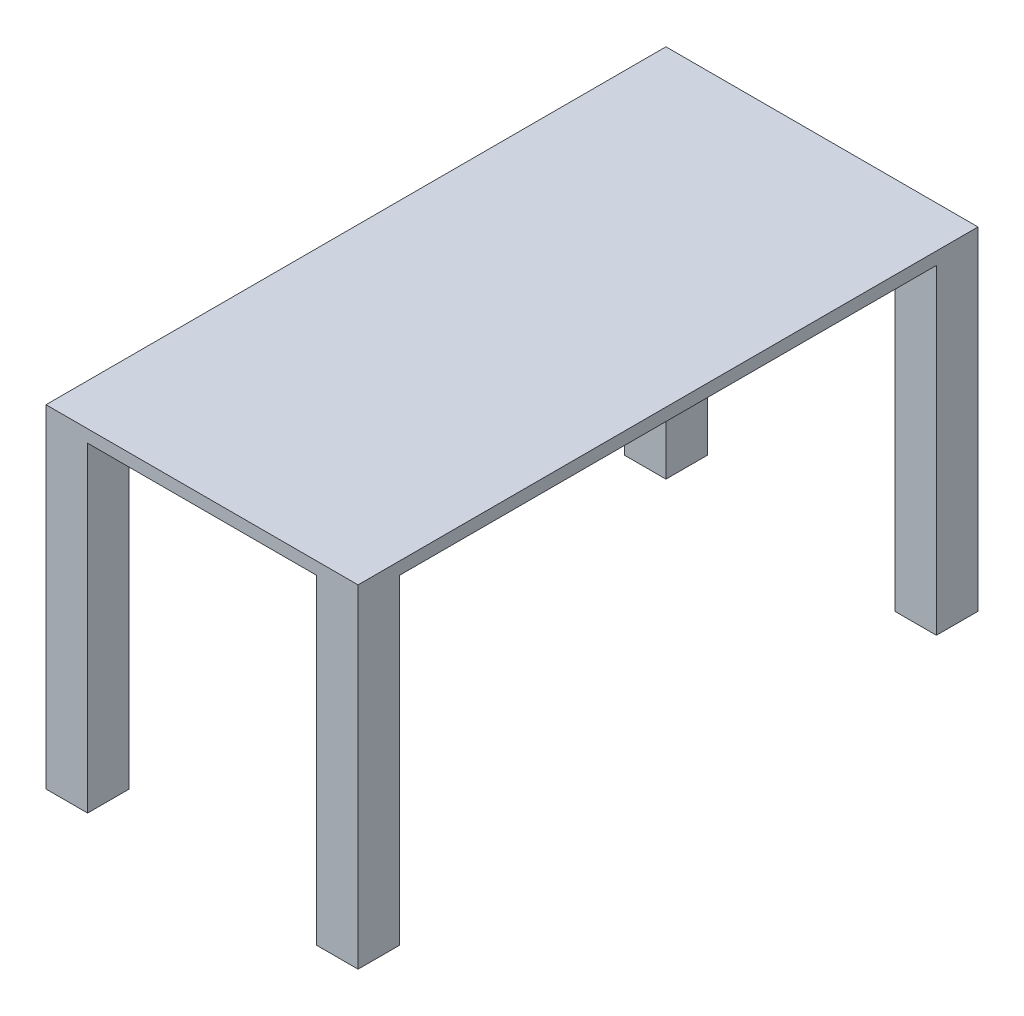
from build123d import *

# Parameters (mm, degrees)
SKETCH1_W           = 750
SKETCH1_H           = 1490
BOSS_EXTRUDE1_DEPTH = 30
SKETCH2_W           = 100
SKETCH2_H           = 100
BOSS_EXTRUDE2_DEPTH = 800


with BuildPart() as part:
    # Sketch1 → Boss-Extrude1 (new body)
    with BuildSketch(Plane(origin=(0, 0, 0), x_dir=(1, 0, 0), z_dir=(0, 1, 0))):
        with Locations((375, 745)):
            Rectangle(SKETCH1_W, SKETCH1_H)
    extrude(amount=BOSS_EXTRUDE1_DEPTH)

    # Sketch2 → Boss-Extrude2 (add)
    with BuildSketch(Plane(origin=(0, 30, 0), x_dir=(1, 0, 0), z_dir=(0, 1, 0))):
        with Locations((50, 50)):
            Rectangle(SKETCH2_W, SKETCH2_H)
        with Locations((700, 50)):
            Rectangle(SKETCH2_W, SKETCH2_H)
        with Locations((700, 1440)):
            Rectangle(SKETCH2_W, SKETCH2_H)
        with Locations((50, 1440)):
            Rectangle(SKETCH2_W, SKETCH2_H)
    extrude(amount=-BOSS_EXTRUDE2_DEPTH)


solid = part.part
